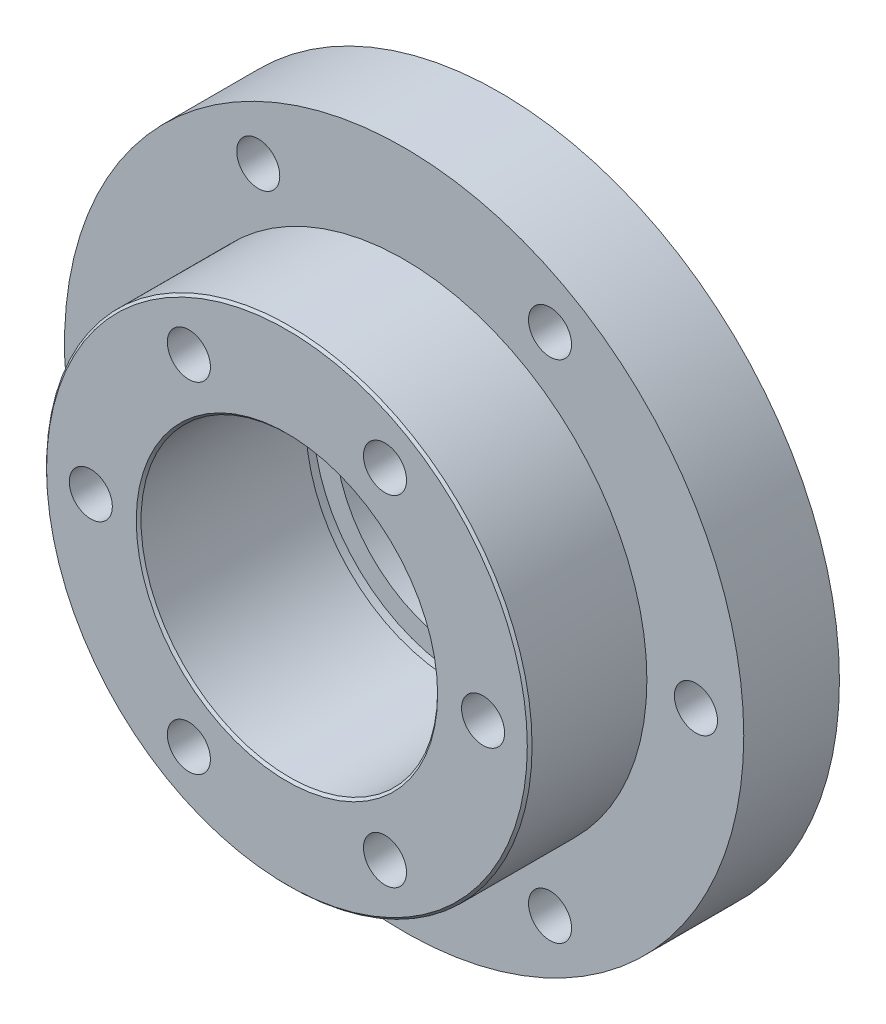
from build123d import *

# Parameters (mm, degrees)
SKETCH_1_R          = 71
EXTRUDE_1_DEPTH     = 20
SKETCH_2_R          = 50.75
EXTRUDE_2_DEPTH     = 24.5
SKETCH_4_R          = 31
CUT_EXTRUDE_1_DEPTH = 35
CHAMFER_1_SIZE      = 0.5
SKETCH_5_R          = 27
CUT_EXTRUDE_2_DEPTH = 8
SKETCH_6_R          = 31.5
CUT_EXTRUDE_3_DEPTH = 2
CUT_EXTRUDE_4_REACH = 105.355
SKETCH_7_R          = 4.5
SKETCH_8_R          = 4
CUT_EXTRUDE_5_DEPTH = 10
SKETCH_9_R          = 4.5
CUT_EXTRUDE_6_DEPTH = 12


with BuildPart() as part:
    # 草图1 → 凸台-拉伸1 (new body)
    with BuildSketch(Plane.XY):
        Circle(SKETCH_1_R)
    extrude(amount=EXTRUDE_1_DEPTH)

    # 草图2 → 凸台-拉伸2 (add)
    with BuildSketch(Plane.XY.offset(20)):
        Circle(SKETCH_2_R)
    extrude(amount=EXTRUDE_2_DEPTH)

    # 草图4 → 切除-拉伸1 (cut)
    with BuildSketch(Plane.XY.offset(44.5)):
        Circle(SKETCH_4_R)
    extrude(amount=-CUT_EXTRUDE_1_DEPTH, mode=Mode.SUBTRACT)

    # 倒角1
    chamfer_1_edges = [part.edges().sort_by_distance(p)[0] for p in [
        (-31, 0, 44.5),
        (-50.75, 0, 44.5),
    ]]
    chamfer(chamfer_1_edges, length=CHAMFER_1_SIZE)

    # 草图5 → 切除-拉伸2 (cut)
    with BuildSketch(Plane(origin=(0, 0, 0), x_dir=(-1, 0, 0), z_dir=(0, 0, -1))):
        Circle(SKETCH_5_R)
    extrude(amount=-CUT_EXTRUDE_2_DEPTH, mode=Mode.SUBTRACT)

    # 草图6 → 切除-拉伸3 (cut)
    with BuildSketch(Plane.XY.offset(9.5)):
        Circle(SKETCH_6_R)
    extrude(amount=-CUT_EXTRUDE_3_DEPTH, mode=Mode.SUBTRACT)

    # 草图7 → 切除-拉伸4 (cut, up to next)
    with BuildSketch(Plane.XY.offset(20), mode=Mode.PRIVATE) as cut_extrude_4_sk1:
        with Locations((-61, 0)):
            Circle(SKETCH_7_R)
    cut_extrude_4_tool1 = extrude(cut_extrude_4_sk1.sketch, amount=-CUT_EXTRUDE_4_REACH, mode=Mode.PRIVATE) & part.part
    # 草图7 → 切除-拉伸4 (cut, up to next)
    with BuildSketch(Plane.XY.offset(20), mode=Mode.PRIVATE) as cut_extrude_4_sk2:
        with Locations((-30.5, 52.827549631)):
            Circle(SKETCH_7_R)
    cut_extrude_4_tool2 = extrude(cut_extrude_4_sk2.sketch, amount=-CUT_EXTRUDE_4_REACH, mode=Mode.PRIVATE) & part.part
    # 草图7 → 切除-拉伸4 (cut, up to next)
    with BuildSketch(Plane.XY.offset(20), mode=Mode.PRIVATE) as cut_extrude_4_sk3:
        with Locations((30.5, 52.827549631)):
            Circle(SKETCH_7_R)
    cut_extrude_4_tool3 = extrude(cut_extrude_4_sk3.sketch, amount=-CUT_EXTRUDE_4_REACH, mode=Mode.PRIVATE) & part.part
    # 草图7 → 切除-拉伸4 (cut, up to next)
    with BuildSketch(Plane.XY.offset(20), mode=Mode.PRIVATE) as cut_extrude_4_sk4:
        with Locations((61, 0)):
            Circle(SKETCH_7_R)
    cut_extrude_4_tool4 = extrude(cut_extrude_4_sk4.sketch, amount=-CUT_EXTRUDE_4_REACH, mode=Mode.PRIVATE) & part.part
    # 草图7 → 切除-拉伸4 (cut, up to next)
    with BuildSketch(Plane.XY.offset(20), mode=Mode.PRIVATE) as cut_extrude_4_sk5:
        with Locations((30.5, -52.827549631)):
            Circle(SKETCH_7_R)
    cut_extrude_4_tool5 = extrude(cut_extrude_4_sk5.sketch, amount=-CUT_EXTRUDE_4_REACH, mode=Mode.PRIVATE) & part.part
    # 草图7 → 切除-拉伸4 (cut, up to next)
    with BuildSketch(Plane.XY.offset(20), mode=Mode.PRIVATE) as cut_extrude_4_sk6:
        with Locations((-30.5, -52.827549631)):
            Circle(SKETCH_7_R)
    cut_extrude_4_tool6 = extrude(cut_extrude_4_sk6.sketch, amount=-CUT_EXTRUDE_4_REACH, mode=Mode.PRIVATE) & part.part
    add(cut_extrude_4_tool1.solids().sort_by_distance((-61, 0, 20))[0], mode=Mode.SUBTRACT)
    add(cut_extrude_4_tool2.solids().sort_by_distance((-30.5, 52.82755, 20))[0], mode=Mode.SUBTRACT)
    add(cut_extrude_4_tool3.solids().sort_by_distance((30.5, 52.82755, 20))[0], mode=Mode.SUBTRACT)
    add(cut_extrude_4_tool4.solids().sort_by_distance((61, 0, 20))[0], mode=Mode.SUBTRACT)
    add(cut_extrude_4_tool5.solids().sort_by_distance((30.5, -52.82755, 20))[0], mode=Mode.SUBTRACT)
    add(cut_extrude_4_tool6.solids().sort_by_distance((-30.5, -52.82755, 20))[0], mode=Mode.SUBTRACT)

    # 草图8 → 切除-拉伸5 (cut)
    with BuildSketch(Plane(origin=(0, 0, 0), x_dir=(-1, 0, 0), z_dir=(0, 0, -1))):
        with Locations((-41, 0)):
            Circle(SKETCH_8_R)
    extrude(amount=-CUT_EXTRUDE_5_DEPTH, mode=Mode.SUBTRACT)

    # 草图9 → 切除-拉伸6 (cut)
    with BuildSketch(Plane.XY.offset(44.5)):
        with Locations((41, 0)):
            Circle(SKETCH_9_R)
        with Locations((20.5, -35.507041555)):
            Circle(SKETCH_9_R)
        with Locations((-20.5, -35.507041555)):
            Circle(SKETCH_9_R)
        with Locations((-41, 0)):
            Circle(SKETCH_9_R)
        with Locations((-20.5, 35.507041555)):
            Circle(SKETCH_9_R)
        with Locations((20.5, 35.507041555)):
            Circle(SKETCH_9_R)
    extrude(amount=-CUT_EXTRUDE_6_DEPTH, mode=Mode.SUBTRACT)


solid = part.part
